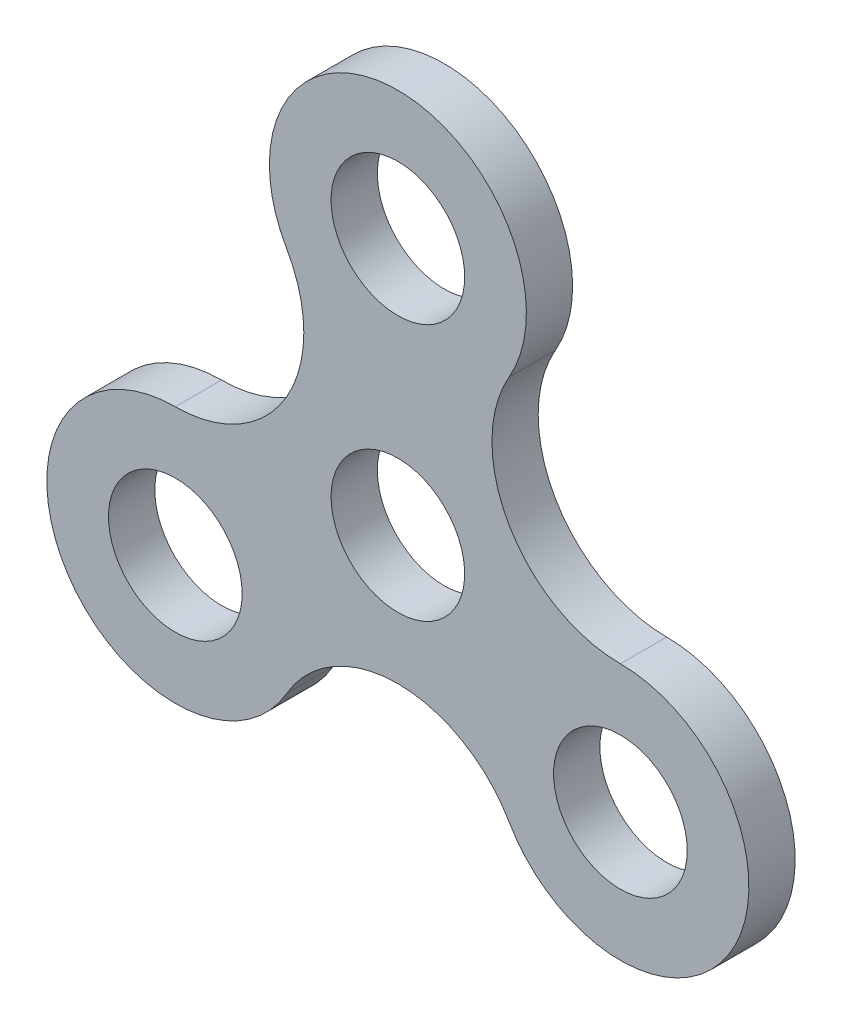
from build123d import *

# Parameters (mm, degrees)
BOSS_EXTRUDE1_DEPTH = 45
SKETCH3_R           = 130
CUT_EXTRUDE1_DEPTH  = 1019.38418632
SKETCH2_R           = 130
CUT_EXTRUDE2_DEPTH  = 1019.38418632


with BuildPart() as part:
    # Sketch1 → Boss-Extrude1 (new, symmetric)
    with BuildSketch(Plane.XY):
        with BuildLine():
            ThreePointArc((-433.012701892, 0), (-649.519052838, -375), (-216.506350946, -375))
            ThreePointArc((-216.506350946, -375), (0, -250), (216.506350946, -375))
            ThreePointArc((216.506350946, -375), (649.519052838, -375), (433.012701892, 0))
            ThreePointArc((433.012701892, 0), (216.506350946, 125), (216.506350946, 375))
            ThreePointArc((216.506350946, 375), (0, 750), (-216.506350946, 375))
            ThreePointArc((-216.506350946, 375), (-216.506350946, 125), (-433.012701892, 0))
        make_face()
    extrude(amount=BOSS_EXTRUDE1_DEPTH, both=True)

    # Sketch3 → Cut-Extrude1 (cut, through all)
    with BuildSketch(Plane(origin=(0, 0, -45), x_dir=(-1, 0, 0), z_dir=(0, 0, -1))):
        Circle(SKETCH3_R)
    extrude(amount=-CUT_EXTRUDE1_DEPTH, mode=Mode.SUBTRACT)

    # Sketch2 → Cut-Extrude2 (cut, through all)
    with BuildSketch(Plane.XY.offset(45)):
        with Locations((-433.012701892, -250)):
            Circle(SKETCH2_R)
        with Locations((433.012701892, -250)):
            Circle(SKETCH2_R)
        with Locations((0, 500)):
            Circle(SKETCH2_R)
    extrude(amount=-CUT_EXTRUDE2_DEPTH, mode=Mode.SUBTRACT)


solid = part.part
